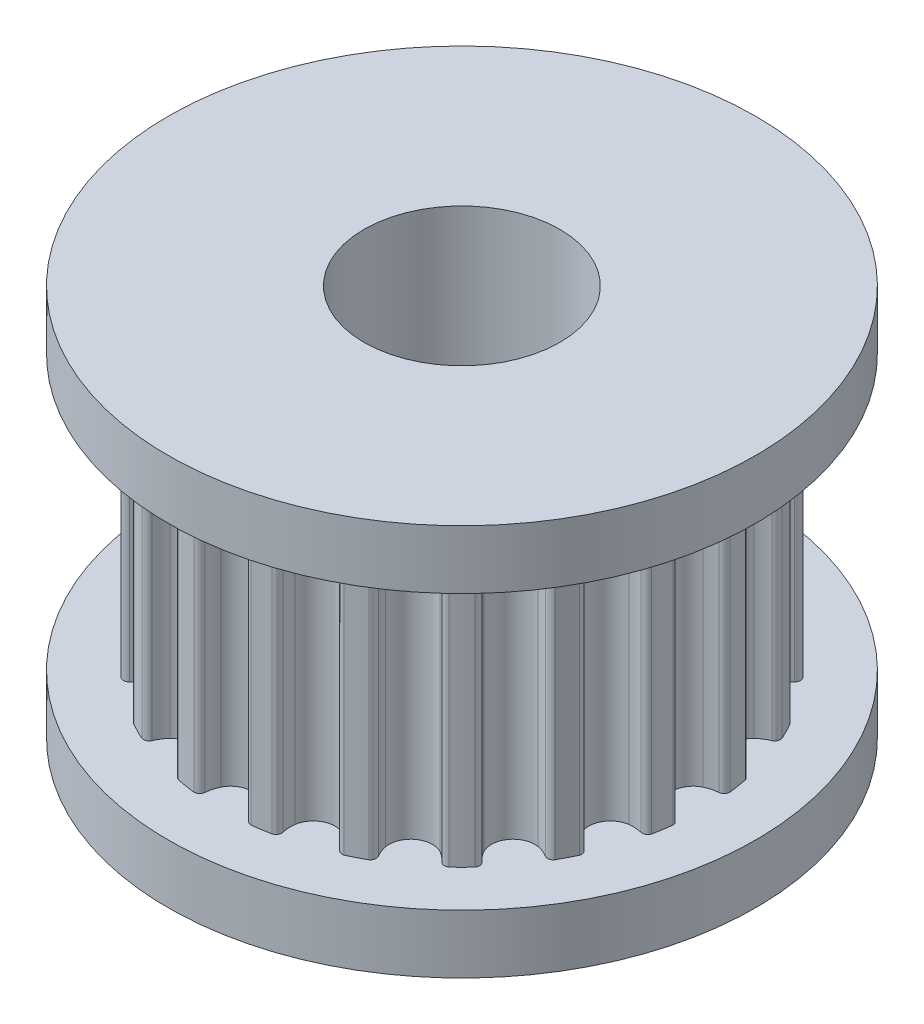
from build123d import *

# Parameters (mm, degrees)
SKETCH2_R           = 6.366203101
SKETCH2_R_2         = 4.366203101
CUT_EXTRUDE1_DEPTH  = 7
SKETCH3_R           = 4.366203101
SKETCH3_R_2         = 1.5
BOSS_EXTRUDE1_DEPTH = 7


with BuildPart() as part:
    # Sketch1 → Revolve1 (revolve)
    with BuildSketch(Plane.XY, mode=Mode.PRIVATE) as revolve1_sk:
        Polygon((2.5, 0), (2.5, 10), (7.5, 10), (7.5, 8.5), (6.366203101, 8.5), (6.366203101, 1.5), (7.5, 1.5), (7.5, 0), align=None)
    revolve(revolve1_sk.sketch.rotate(Axis((0, 0, 0), (0, 1, 0)), 90), axis=Axis((0, 0, 0), (0, 1, 0)))

    # Sketch2 → Cut-Extrude1 (cut)
    with BuildSketch(Plane(origin=(0, 1.5, 0), x_dir=(1, 0, 0), z_dir=(0, 1, 0))):
        Circle(SKETCH2_R)
        with Locations(Location((0, 0, 0), (0, 0, 90))):
            Circle(SKETCH2_R_2, mode=Mode.SUBTRACT)
    extrude(amount=CUT_EXTRUDE1_DEPTH, mode=Mode.SUBTRACT)

    # Sketch3 → Boss-Extrude1 (add)
    # profile 1 of 2: a face of its own
    with BuildSketch(Plane(origin=(0, 1.5, 0), x_dir=(1, 0, 0), z_dir=(0, 1, 0))):
        with BuildLine():
            ThreePointArc((6.113457662, -0.730340473), (6.076174412, -0.631371113), (5.98285854, -0.581600411))
            ThreePointArc((5.98285854, -0.581600411), (5.817334791, -0.552657178), (5.658994178, -0.496407091))
            ThreePointArc((5.658994178, -0.496407091), (5.435086525, -0.291780767), (5.352197724, 0))
            ThreePointArc((5.352197724, 0), (5.435086525, 0.291780767), (5.658994178, 0.496407091))
            ThreePointArc((5.658994178, 0.496407091), (5.817334791, 0.552657178), (5.98285854, 0.581600411))
            ThreePointArc((5.98285854, 0.581600411), (6.076174412, 0.631371113), (6.113457662, 0.730340473))
            ThreePointArc((6.113457662, 0.730340473), (6.081158405, 0.96316087), (6.039931364, 1.194567246))
            ThreePointArc((6.039931364, 1.194567246), (5.973889673, 1.277171543), (5.869761011, 1.295670103))
            ThreePointArc((5.869761011, 1.295670103), (5.703394621, 1.272047103), (5.535421516, 1.276614173))
            ThreePointArc((5.535421516, 1.276614173), (5.259239672, 1.402034102), (5.090242522, 1.653920054))
            ThreePointArc((5.090242522, 1.653920054), (5.078909241, 1.957034102), (5.228625062, 2.220836571))
            ThreePointArc((5.228625062, 2.220836571), (5.361833701, 2.323263522), (5.510312189, 2.401939825))
            ThreePointArc((5.510312189, 2.401939825), (5.583680865, 2.478110765), (5.588556129, 2.583757378))
            ThreePointArc((5.588556129, 2.583757378), (5.48589225, 2.795201715), (5.375174502, 3.0025424))
            ThreePointArc((5.375174502, 3.0025424), (5.286838989, 3.06069575), (5.182090378, 3.0461114))
            ThreePointArc((5.182090378, 3.0461114), (5.031166447, 2.972234549), (4.870003228, 2.924671548))
            ThreePointArc((4.870003228, 2.924671548), (4.568581797, 2.958608105), (4.330018916, 3.145942889))
            ThreePointArc((4.330018916, 3.145942889), (4.225572933, 3.430719304), (4.286441694, 3.727875093))
            ThreePointArc((4.286441694, 3.727875093), (4.38147897, 3.866452647), (4.498378089, 3.987160633))
            ThreePointArc((4.498378089, 3.987160633), (4.544617731, 4.08227567), (4.516607784, 4.184258108))
            ThreePointArc((4.516607784, 4.184258108), (4.35362874, 4.35362874), (4.184258108, 4.516607784))
            ThreePointArc((4.184258108, 4.516607784), (4.08227567, 4.544617731), (3.987160633, 4.498378089))
            ThreePointArc((3.987160633, 4.498378089), (3.866452647, 4.38147897), (3.727875093, 4.286441694))
            ThreePointArc((3.727875093, 4.286441694), (3.430719304, 4.225572933), (3.145942889, 4.330018916))
            ThreePointArc((3.145942889, 4.330018916), (2.958608105, 4.568581797), (2.924671548, 4.870003228))
            ThreePointArc((2.924671548, 4.870003228), (2.972234549, 5.031166447), (3.0461114, 5.182090378))
            ThreePointArc((3.0461114, 5.182090378), (3.06069575, 5.286838989), (3.0025424, 5.375174502))
            ThreePointArc((3.0025424, 5.375174502), (2.795201715, 5.48589225), (2.583757378, 5.588556129))
            ThreePointArc((2.583757378, 5.588556129), (2.478110765, 5.583680865), (2.401939825, 5.510312189))
            ThreePointArc((2.401939825, 5.510312189), (2.323263522, 5.361833701), (2.220836571, 5.228625062))
            ThreePointArc((2.220836571, 5.228625062), (1.957034102, 5.078909241), (1.653920054, 5.090242522))
            ThreePointArc((1.653920054, 5.090242522), (1.402034102, 5.259239672), (1.276614173, 5.535421516))
            ThreePointArc((1.276614173, 5.535421516), (1.272047103, 5.703394621), (1.295670103, 5.869761011))
            ThreePointArc((1.295670103, 5.869761011), (1.277171543, 5.973889673), (1.194567246, 6.039931364))
            ThreePointArc((1.194567246, 6.039931364), (0.96316087, 6.081158405), (0.730340473, 6.113457662))
            ThreePointArc((0.730340473, 6.113457662), (0.631371113, 6.076174412), (0.581600411, 5.98285854))
            ThreePointArc((0.581600411, 5.98285854), (0.552657178, 5.817334791), (0.496407091, 5.658994178))
            ThreePointArc((0.496407091, 5.658994178), (0.291780767, 5.435086525), (0, 5.352197724))
            ThreePointArc((0, 5.352197724), (-0.291780767, 5.435086525), (-0.496407091, 5.658994178))
            ThreePointArc((-0.496407091, 5.658994178), (-0.552657178, 5.817334791), (-0.581600411, 5.98285854))
            ThreePointArc((-0.581600411, 5.98285854), (-0.631371113, 6.076174412), (-0.730340473, 6.113457662))
            ThreePointArc((-0.730340473, 6.113457662), (-0.96316087, 6.081158405), (-1.194567246, 6.039931364))
            ThreePointArc((-1.194567246, 6.039931364), (-1.277171543, 5.973889673), (-1.295670103, 5.869761011))
            ThreePointArc((-1.295670103, 5.869761011), (-1.272047103, 5.703394621), (-1.276614173, 5.535421516))
            ThreePointArc((-1.276614173, 5.535421516), (-1.402034102, 5.259239672), (-1.653920054, 5.090242522))
            ThreePointArc((-1.653920054, 5.090242522), (-1.957034102, 5.078909241), (-2.220836571, 5.228625062))
            ThreePointArc((-2.220836571, 5.228625062), (-2.323263522, 5.361833701), (-2.401939825, 5.510312189))
            ThreePointArc((-2.401939825, 5.510312189), (-2.478110765, 5.583680865), (-2.583757378, 5.588556129))
            ThreePointArc((-2.583757378, 5.588556129), (-2.795201715, 5.48589225), (-3.0025424, 5.375174502))
            ThreePointArc((-3.0025424, 5.375174502), (-3.06069575, 5.286838989), (-3.0461114, 5.182090378))
            ThreePointArc((-3.0461114, 5.182090378), (-2.972234549, 5.031166447), (-2.924671548, 4.870003228))
            ThreePointArc((-2.924671548, 4.870003228), (-2.958608105, 4.568581797), (-3.145942889, 4.330018916))
            ThreePointArc((-3.145942889, 4.330018916), (-3.430719304, 4.225572933), (-3.727875093, 4.286441694))
            ThreePointArc((-3.727875093, 4.286441694), (-3.866452647, 4.38147897), (-3.987160633, 4.498378089))
            ThreePointArc((-3.987160633, 4.498378089), (-4.08227567, 4.544617731), (-4.184258108, 4.516607784))
            ThreePointArc((-4.184258108, 4.516607784), (-4.35362874, 4.35362874), (-4.516607784, 4.184258108))
            ThreePointArc((-4.516607784, 4.184258108), (-4.544617731, 4.08227567), (-4.498378089, 3.987160633))
            ThreePointArc((-4.498378089, 3.987160633), (-4.38147897, 3.866452647), (-4.286441694, 3.727875093))
            ThreePointArc((-4.286441694, 3.727875093), (-4.225572933, 3.430719304), (-4.330018916, 3.145942889))
            ThreePointArc((-4.330018916, 3.145942889), (-4.568581797, 2.958608105), (-4.870003228, 2.924671548))
            ThreePointArc((-4.870003228, 2.924671548), (-5.031166447, 2.972234549), (-5.182090378, 3.0461114))
            ThreePointArc((-5.182090378, 3.0461114), (-5.286838989, 3.06069575), (-5.375174502, 3.0025424))
            ThreePointArc((-5.375174502, 3.0025424), (-5.48589225, 2.795201715), (-5.588556129, 2.583757378))
            ThreePointArc((-5.588556129, 2.583757378), (-5.583680865, 2.478110765), (-5.510312189, 2.401939825))
            ThreePointArc((-5.510312189, 2.401939825), (-5.361833701, 2.323263522), (-5.228625062, 2.220836571))
            ThreePointArc((-5.228625062, 2.220836571), (-5.078909241, 1.957034102), (-5.090242522, 1.653920054))
            ThreePointArc((-5.090242522, 1.653920054), (-5.259239672, 1.402034102), (-5.535421516, 1.276614173))
            ThreePointArc((-5.535421516, 1.276614173), (-5.703394621, 1.272047103), (-5.869761011, 1.295670103))
            ThreePointArc((-5.869761011, 1.295670103), (-5.973889673, 1.277171543), (-6.039931364, 1.194567246))
            ThreePointArc((-6.039931364, 1.194567246), (-6.081158405, 0.96316087), (-6.113457662, 0.730340473))
            ThreePointArc((-6.113457662, 0.730340473), (-6.076174412, 0.631371113), (-5.98285854, 0.581600411))
            ThreePointArc((-5.98285854, 0.581600411), (-5.817334791, 0.552657178), (-5.658994178, 0.496407091))
            ThreePointArc((-5.658994178, 0.496407091), (-5.435086525, 0.291780767), (-5.352197724, 0))
            ThreePointArc((-5.352197724, 0), (-5.435086525, -0.291780767), (-5.658994178, -0.496407091))
            ThreePointArc((-5.658994178, -0.496407091), (-5.817334791, -0.552657178), (-5.98285854, -0.581600411))
            ThreePointArc((-5.98285854, -0.581600411), (-6.076174412, -0.631371113), (-6.113457662, -0.730340473))
            ThreePointArc((-6.113457662, -0.730340473), (-6.081158405, -0.96316087), (-6.039931364, -1.194567246))
            ThreePointArc((-6.039931364, -1.194567246), (-5.973889673, -1.277171543), (-5.869761011, -1.295670103))
            ThreePointArc((-5.869761011, -1.295670103), (-5.703394621, -1.272047103), (-5.535421516, -1.276614173))
            ThreePointArc((-5.535421516, -1.276614173), (-5.259239672, -1.402034102), (-5.090242522, -1.653920054))
            ThreePointArc((-5.090242522, -1.653920054), (-5.078909241, -1.957034102), (-5.228625062, -2.220836571))
            ThreePointArc((-5.228625062, -2.220836571), (-5.361833701, -2.323263522), (-5.510312189, -2.401939825))
            ThreePointArc((-5.510312189, -2.401939825), (-5.583680865, -2.478110765), (-5.588556129, -2.583757378))
            ThreePointArc((-5.588556129, -2.583757378), (-5.48589225, -2.795201715), (-5.375174502, -3.0025424))
            ThreePointArc((-5.375174502, -3.0025424), (-5.286838989, -3.06069575), (-5.182090378, -3.0461114))
            ThreePointArc((-5.182090378, -3.0461114), (-5.031166447, -2.972234549), (-4.870003228, -2.924671548))
            ThreePointArc((-4.870003228, -2.924671548), (-4.568581797, -2.958608105), (-4.330018916, -3.145942889))
            ThreePointArc((-4.330018916, -3.145942889), (-4.225572933, -3.430719304), (-4.286441694, -3.727875093))
            ThreePointArc((-4.286441694, -3.727875093), (-4.38147897, -3.866452647), (-4.498378089, -3.987160633))
            ThreePointArc((-4.498378089, -3.987160633), (-4.544617731, -4.08227567), (-4.516607784, -4.184258108))
            ThreePointArc((-4.516607784, -4.184258108), (-4.35362874, -4.35362874), (-4.184258108, -4.516607784))
            ThreePointArc((-4.184258108, -4.516607784), (-4.08227567, -4.544617731), (-3.987160633, -4.498378089))
            ThreePointArc((-3.987160633, -4.498378089), (-3.866452647, -4.38147897), (-3.727875093, -4.286441694))
            ThreePointArc((-3.727875093, -4.286441694), (-3.430719304, -4.225572933), (-3.145942889, -4.330018916))
            ThreePointArc((-3.145942889, -4.330018916), (-2.958608105, -4.568581797), (-2.924671548, -4.870003228))
            ThreePointArc((-2.924671548, -4.870003228), (-2.972234549, -5.031166447), (-3.0461114, -5.182090378))
            ThreePointArc((-3.0461114, -5.182090378), (-3.06069575, -5.286838989), (-3.0025424, -5.375174502))
            ThreePointArc((-3.0025424, -5.375174502), (-2.795201715, -5.48589225), (-2.583757378, -5.588556129))
            ThreePointArc((-2.583757378, -5.588556129), (-2.478110765, -5.583680865), (-2.401939825, -5.510312189))
            ThreePointArc((-2.401939825, -5.510312189), (-2.323263522, -5.361833701), (-2.220836571, -5.228625062))
            ThreePointArc((-2.220836571, -5.228625062), (-1.957034102, -5.078909241), (-1.653920054, -5.090242522))
            ThreePointArc((-1.653920054, -5.090242522), (-1.402034102, -5.259239672), (-1.276614173, -5.535421516))
            ThreePointArc((-1.276614173, -5.535421516), (-1.272047103, -5.703394621), (-1.295670103, -5.869761011))
            ThreePointArc((-1.295670103, -5.869761011), (-1.277171543, -5.973889673), (-1.194567246, -6.039931364))
            ThreePointArc((-1.194567246, -6.039931364), (-0.96316087, -6.081158405), (-0.730340473, -6.113457662))
            ThreePointArc((-0.730340473, -6.113457662), (-0.631371113, -6.076174412), (-0.581600411, -5.98285854))
            ThreePointArc((-0.581600411, -5.98285854), (-0.552657178, -5.817334791), (-0.496407091, -5.658994178))
            ThreePointArc((-0.496407091, -5.658994178), (-0.291780767, -5.435086525), (0, -5.352197724))
            ThreePointArc((0, -5.352197724), (0.291780767, -5.435086525), (0.496407091, -5.658994178))
            ThreePointArc((0.496407091, -5.658994178), (0.552657178, -5.817334791), (0.581600411, -5.98285854))
            ThreePointArc((0.581600411, -5.98285854), (0.631371113, -6.076174412), (0.730340473, -6.113457662))
            ThreePointArc((0.730340473, -6.113457662), (0.96316087, -6.081158405), (1.194567246, -6.039931364))
            ThreePointArc((1.194567246, -6.039931364), (1.277171543, -5.973889673), (1.295670103, -5.869761011))
            ThreePointArc((1.295670103, -5.869761011), (1.272047103, -5.703394621), (1.276614173, -5.535421516))
            ThreePointArc((1.276614173, -5.535421516), (1.402034102, -5.259239672), (1.653920054, -5.090242522))
            ThreePointArc((1.653920054, -5.090242522), (1.957034102, -5.078909241), (2.220836571, -5.228625062))
            ThreePointArc((2.220836571, -5.228625062), (2.323263522, -5.361833701), (2.401939825, -5.510312189))
            ThreePointArc((2.401939825, -5.510312189), (2.478110765, -5.583680865), (2.583757378, -5.588556129))
            ThreePointArc((2.583757378, -5.588556129), (2.795201715, -5.48589225), (3.0025424, -5.375174502))
            ThreePointArc((3.0025424, -5.375174502), (3.06069575, -5.286838989), (3.0461114, -5.182090378))
            ThreePointArc((3.0461114, -5.182090378), (2.972234549, -5.031166447), (2.924671548, -4.870003228))
            ThreePointArc((2.924671548, -4.870003228), (2.958608105, -4.568581797), (3.145942889, -4.330018916))
            ThreePointArc((3.145942889, -4.330018916), (3.430719304, -4.225572933), (3.727875093, -4.286441694))
            ThreePointArc((3.727875093, -4.286441694), (3.866452647, -4.38147897), (3.987160633, -4.498378089))
            ThreePointArc((3.987160633, -4.498378089), (4.08227567, -4.544617731), (4.184258108, -4.516607784))
            ThreePointArc((4.184258108, -4.516607784), (4.35362874, -4.35362874), (4.516607784, -4.184258108))
            ThreePointArc((4.516607784, -4.184258108), (4.544617731, -4.08227567), (4.498378089, -3.987160633))
            ThreePointArc((4.498378089, -3.987160633), (4.38147897, -3.866452647), (4.286441694, -3.727875093))
            ThreePointArc((4.286441694, -3.727875093), (4.225572933, -3.430719304), (4.330018916, -3.145942889))
            ThreePointArc((4.330018916, -3.145942889), (4.568581797, -2.958608105), (4.870003228, -2.924671548))
            ThreePointArc((4.870003228, -2.924671548), (5.031166447, -2.972234549), (5.182090378, -3.0461114))
            ThreePointArc((5.182090378, -3.0461114), (5.286838989, -3.06069575), (5.375174502, -3.0025424))
            ThreePointArc((5.375174502, -3.0025424), (5.48589225, -2.795201715), (5.588556129, -2.583757378))
            ThreePointArc((5.588556129, -2.583757378), (5.583680865, -2.478110765), (5.510312189, -2.401939825))
            ThreePointArc((5.510312189, -2.401939825), (5.361833701, -2.323263522), (5.228625062, -2.220836571))
            ThreePointArc((5.228625062, -2.220836571), (5.078909241, -1.957034102), (5.090242522, -1.653920054))
            ThreePointArc((5.090242522, -1.653920054), (5.259239672, -1.402034102), (5.535421516, -1.276614173))
            ThreePointArc((5.535421516, -1.276614173), (5.703394621, -1.272047103), (5.869761011, -1.295670103))
            ThreePointArc((5.869761011, -1.295670103), (5.973889673, -1.277171543), (6.039931364, -1.194567246))
            ThreePointArc((6.039931364, -1.194567246), (6.081158405, -0.96316087), (6.113457662, -0.730340473))
        make_face()
        Circle(SKETCH3_R, mode=Mode.SUBTRACT)
    # profile 2 of 2: a face of its own
    with BuildSketch(Plane(origin=(0, 1.5, 0), x_dir=(1, 0, 0), z_dir=(0, 1, 0))):
        Circle(SKETCH3_R_2)
    extrude(amount=BOSS_EXTRUDE1_DEPTH)


with BuildPart() as boss_extrude1_kept_piece:
    # of the separate pieces the step leaves, the one the design keeps (boss_extrude1_pieces_kept)
    add(part.part.solids().sort_by_distance((0, 0, -2.5))[0])


solid = boss_extrude1_kept_piece.part
